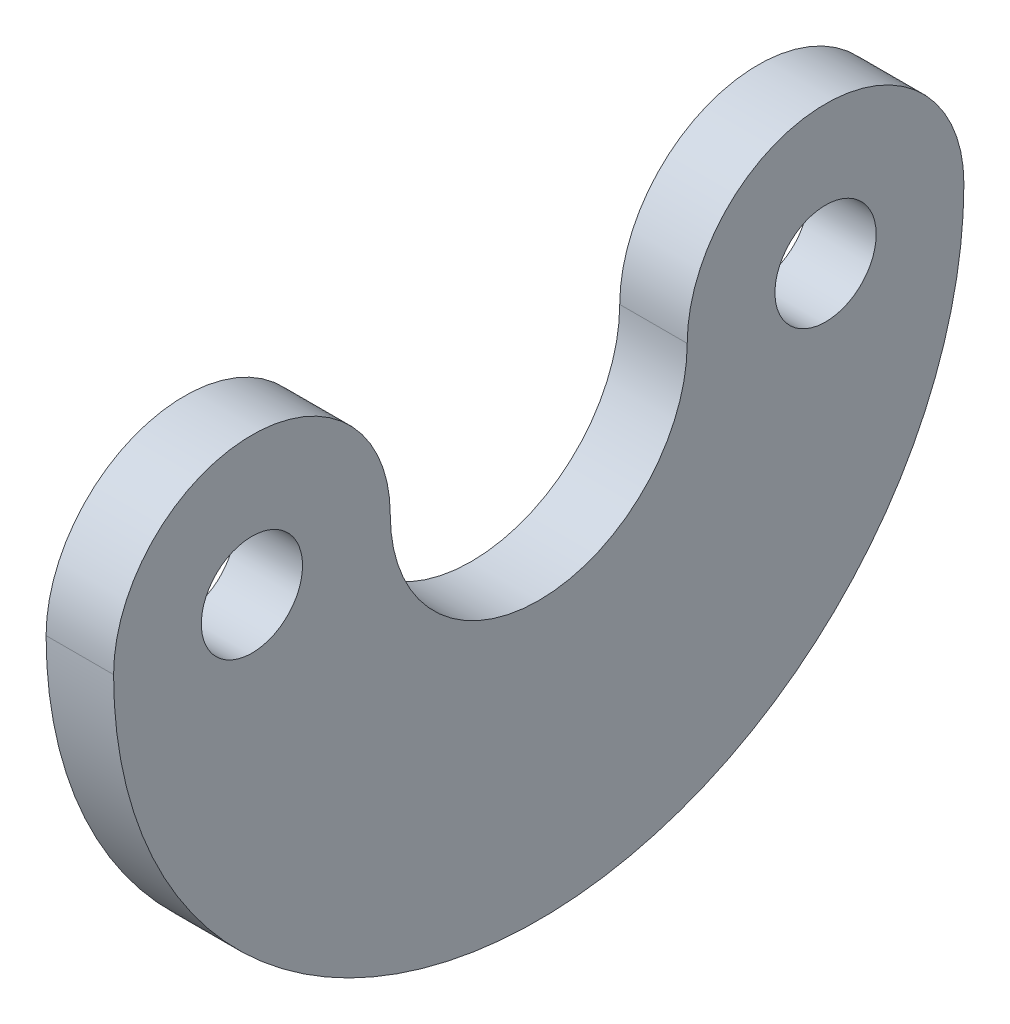
from build123d import *

# Parameters (mm, degrees)
SKETCH1_R           = 1.5
BOSS_EXTRUDE1_DEPTH = 2


with BuildPart() as part:
    # Sketch1 → Boss-Extrude1 (new body)
    with BuildSketch(Plane(origin=(0, 0, 0), x_dir=(0, 0, -1), z_dir=(1, 0, 0))):
        with BuildLine():
            ThreePointArc((-4.4, 0), (0, -4.4), (4.4, 0))
            ThreePointArc((4.4, 0), (8.5, 4.1), (12.6, 0))
            ThreePointArc((12.6, 0), (0, -12.6), (-12.6, 0))
            ThreePointArc((-12.6, 0), (-8.5, 4.1), (-4.4, 0))
        make_face()
        with Locations((-8.5, 0)):
            Circle(SKETCH1_R, mode=Mode.SUBTRACT)
        with Locations((8.5, 0)):
            Circle(SKETCH1_R, mode=Mode.SUBTRACT)
    extrude(amount=BOSS_EXTRUDE1_DEPTH)


solid = part.part
